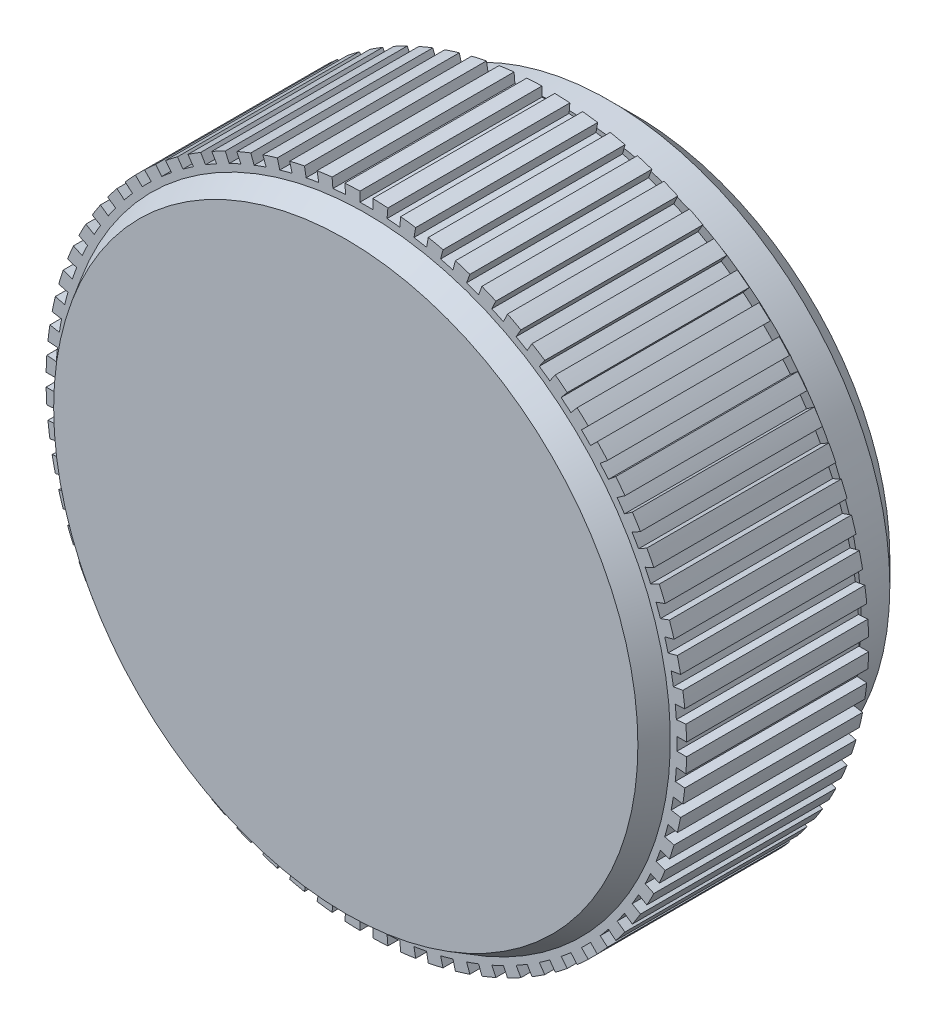
from build123d import *

# Parameters (mm, degrees)
SKETCH1_R               = 3.175
EXTRUDE1_DEPTH          = 3.175
SKETCH21_R              = 5
BOSS_EXTRUDE1_DEPTH     = 4.5
SKETCH34_R              = 5
SKETCH34_R_2            = 4.375
CUT_EXTRUDE4_DEPTH      = 1.016
CUT_EXTRUDE1_REACH      = 14.052
CUT_EXTRUDE1_END_RADIUS = 5
SKETCH22_W              = 0.2
SKETCH22_H              = 4.5
CIRPATTERN1_COUNT       = 72
CHAMFER3_SIZE           = 0.381
SKETCH35_R              = 2.75
SKETCH35_R_2            = 1.25
CUT_EXTRUDE5_DEPTH      = 1.5
SKETCH36_R              = 1.25
CUT_EXTRUDE6_DEPTH      = 3.024


with BuildPart() as part:
    # Sketch1 → Extrude1 (new body)
    with BuildSketch(Plane.XY):
        Circle(SKETCH1_R)
    extrude(amount=EXTRUDE1_DEPTH)

    # Sketch21 → Boss-Extrude1 (add)
    with BuildSketch(Plane.XY):
        Circle(SKETCH21_R)
    extrude(amount=BOSS_EXTRUDE1_DEPTH)

    # Sketch34 → Cut-Extrude4 (cut)
    with BuildSketch(Plane(origin=(0, 0, 0), x_dir=(-1, 0, 0), z_dir=(0, 0, -1))):
        Circle(SKETCH34_R)
        Circle(SKETCH34_R_2, mode=Mode.SUBTRACT)
    extrude(amount=-CUT_EXTRUDE4_DEPTH, mode=Mode.SUBTRACT)

    # Cut-Extrude1: up to this cylinder (the profile starts outside it)
    cut_extrude1_end = Plane(origin=(0, -0.15, 2.25), z_dir=(0, 0, -1)) * Cylinder(CUT_EXTRUDE1_END_RADIUS, 39.104, mode=Mode.PRIVATE)
    # Sketch22 → Cut-Extrude1 (cut, up to the surface)
    with BuildSketch(Plane(origin=(0, 5, 0), x_dir=(-1, 0, 0), z_dir=(0, 1, 0)), mode=Mode.PRIVATE) as cut_extrude1_sk1:
        with Locations((0, 2.25)):
            Rectangle(SKETCH22_W, SKETCH22_H)
    cut_extrude1_tool1 = extrude(cut_extrude1_sk1.sketch, amount=-CUT_EXTRUDE1_REACH, mode=Mode.PRIVATE) - cut_extrude1_end
    cut_extrude1 = cut_extrude1_tool1.solids().sort_by_distance((0, 5, 2.25))[0]
    add(cut_extrude1, mode=Mode.SUBTRACT)

    # CirPattern1: Cut-Extrude1 ×72 about axis
    cirpattern1_axis = Axis((0, 0, 0), (0, 0, 1))
    for i in range(1, CIRPATTERN1_COUNT):
        add(cut_extrude1.rotate(cirpattern1_axis, i * 360 / CIRPATTERN1_COUNT), mode=Mode.SUBTRACT)

    # Sketch29 → Cut-Revolve1 (revolve, cut)
    with BuildSketch(Plane(origin=(0, 0, 0), x_dir=(0, 0, -1), z_dir=(1, 0, 0)), mode=Mode.PRIVATE) as cut_revolve1_sk:
        Polygon((-4.178571429, 4.746), (-4.5, 4.560423128), (-4.5, 5.254), (-4.178571429, 5.254), align=None)
        Polygon((-1.016, 5.254), (-1.337428571, 5.254), (-1.337428571, 4.746), (-1.016, 4.560423128), align=None)
    revolve(cut_revolve1_sk.sketch.rotate(Axis((0, 0, 0), (0, 0, 1)), 90), axis=Axis((0, 0, 0), (0, 0, 1)), mode=Mode.SUBTRACT)

    # Chamfer3
    chamfer3_edges = [part.edges().sort_by_distance(p)[0] for p in [
        (4.375, 0, 0),
    ]]
    chamfer(chamfer3_edges, length=CHAMFER3_SIZE)

    # Sketch35 → Cut-Extrude5 (cut)
    with BuildSketch(Plane.XY):
        Circle(SKETCH35_R)
        Circle(SKETCH35_R_2, mode=Mode.SUBTRACT)
    extrude(amount=CUT_EXTRUDE5_DEPTH, mode=Mode.SUBTRACT)

    # Sketch36 → Cut-Extrude6 (cut)
    with BuildSketch(Plane(origin=(0, 0, 0), x_dir=(-1, 0, 0), z_dir=(0, 0, -1))):
        with Locations(Location((0, 0, 0), (0, 0, 180))):
            Circle(SKETCH36_R)
    extrude(amount=-CUT_EXTRUDE6_DEPTH, mode=Mode.SUBTRACT)


solid = part.part
